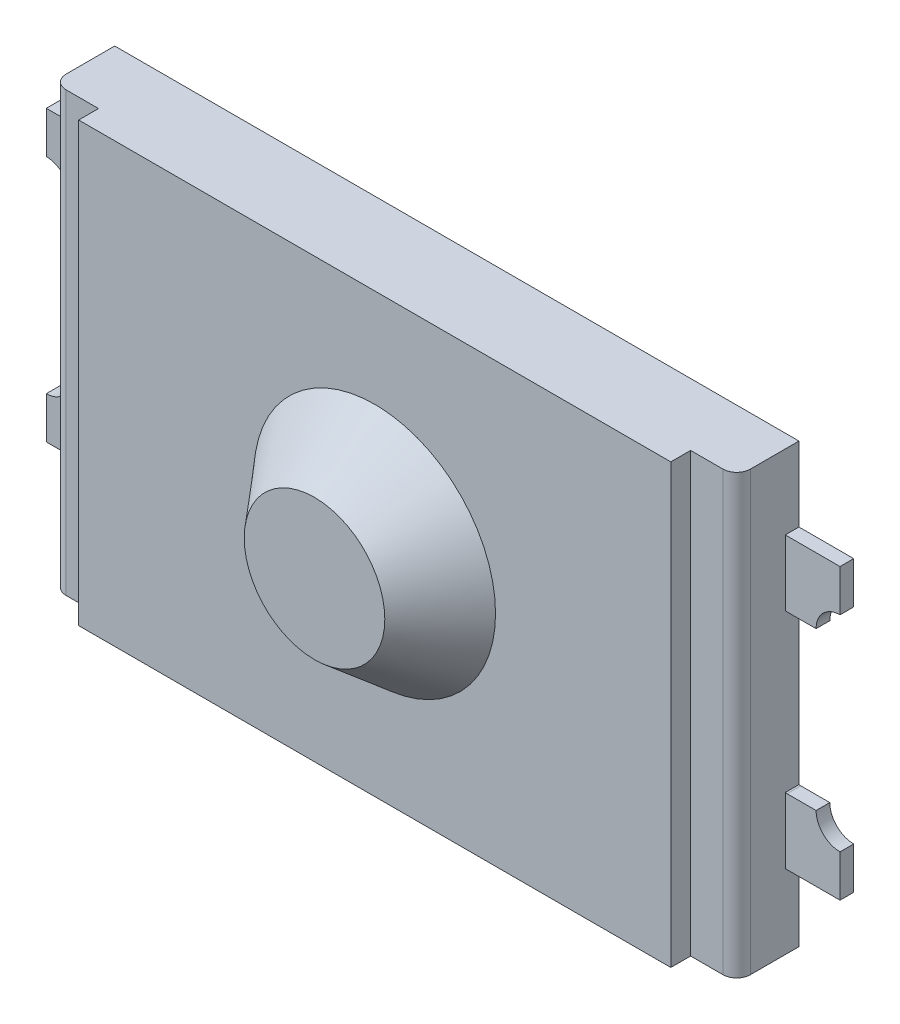
from build123d import *

# Parameters (mm, degrees)
SKETCH1_W                = 2
SKETCH1_H                = 1.5
BOSS_EXTRUDE1_DEPTH      = 0.03
BOSS_EXTRUDE2_DEPTH      = 0.05
BOSS_EXTRUDE3_DEPTH      = 0.8
BOSS_EXTRUDE3_DEPTH_BACK = 0.8
SKETCH4_R                = 0.441371156
BOSS_EXTRUDE5_DEPTH      = 0.22
BOSS_EXTRUDE5_TAPER      = 40


with BuildPart() as part:
    # Sketch1 → Boss-Extrude1 (new body)
    with BuildSketch(Plane.XY):
        Rectangle(SKETCH1_W, SKETCH1_H)
    extrude(amount=BOSS_EXTRUDE1_DEPTH)

    # Sketch2 → Boss-Extrude2 (add)
    with BuildSketch(Plane.XY.offset(0.03)):
        with BuildLine():
            Line((-0.810643371, 0.578370815), (-0.810643371, -0.578370815))
            Line((-0.810643371, -0.578370815), (-1.089503482, -0.578370815))
            Line((-1.089503482, -0.578370815), (-1.089503482, -0.527978988))
            Line((-1.089503482, -0.527978988), (-1.45, -0.527978988))
            Line((-1.45, -0.527978988), (-1.45, -0.375))
            ThreePointArc((-1.45, -0.375), (-1.388226406, -0.349412539), (-1.362638945, -0.287638945))
            Line((-1.362638945, -0.287638945), (-1.256631634, -0.287638945))
            ThreePointArc((-1.256631634, -0.287638945), (-1.221276295, -0.272994284), (-1.206631634, -0.237638945))
            Line((-1.206631634, -0.237638945), (-1.206631634, 0.237638945))
            ThreePointArc((-1.206631634, 0.237638945), (-1.221276295, 0.272994284), (-1.256631634, 0.287638945))
            Line((-1.256631634, 0.287638945), (-1.362638945, 0.287638945))
            ThreePointArc((-1.362638945, 0.287638945), (-1.388226406, 0.349412539), (-1.45, 0.375))
            Line((-1.45, 0.375), (-1.45, 0.527978988))
            Line((-1.45, 0.527978988), (-1.089503482, 0.527978988))
            Line((-1.089503482, 0.527978988), (-1.089503482, 0.578370815))
            Line((-1.089503482, 0.578370815), (-0.810643371, 0.578370815))
        make_face()
    boss_extrude2 = extrude(amount=BOSS_EXTRUDE2_DEPTH)

    # Mirror1: Boss-Extrude2 across plane
    add(boss_extrude2.mirror(Plane(origin=(0, 0, 0), x_dir=(0, 0, 1), z_dir=(1, 0, 0))))


with BuildPart() as body_2:
    # Sketch3 → Boss-Extrude3 (new, two sides: drawn at the far end of the back side and taken through both)
    with BuildSketch(Plane(origin=(0, 0, 0), x_dir=(1, 0, 0), z_dir=(0, 1, 0)).offset(-BOSS_EXTRUDE3_DEPTH_BACK)):
        with BuildLine():
            Line((1.081724283, -0.33), (-1.081724283, -0.33))
            Line((-1.081724283, -0.33), (-1.081724283, -0.257546264))
            Line((-1.081724283, -0.257546264), (-1.2, -0.257546264))
            ThreePointArc((-1.2, -0.257546264), (-1.235355339, -0.242901603), (-1.25, -0.207546264))
            Line((-1.25, -0.207546264), (-1.25, -0.03))
            Line((-1.25, -0.03), (1.25, -0.03))
            Line((1.25, -0.03), (1.25, -0.207546264))
            ThreePointArc((1.25, -0.207546264), (1.235355339, -0.242901603), (1.2, -0.257546264))
            Line((1.2, -0.257546264), (1.081724283, -0.257546264))
            Line((1.081724283, -0.257546264), (1.081724283, -0.33))
        make_face()
    extrude(amount=BOSS_EXTRUDE3_DEPTH + BOSS_EXTRUDE3_DEPTH_BACK)

    # Sketch4 → Boss-Extrude5 (add)
    with BuildSketch(Plane.XY.offset(0.33)):
        Circle(SKETCH4_R)
    extrude(amount=BOSS_EXTRUDE5_DEPTH, taper=BOSS_EXTRUDE5_TAPER)


solid = Compound([part.part, body_2.part])
